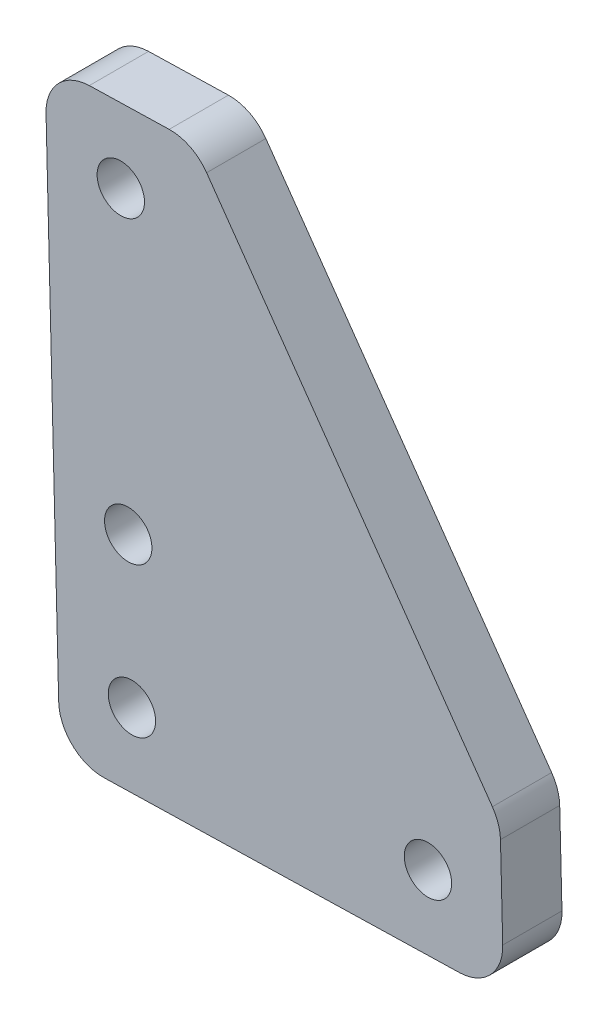
from build123d import *

# Parameters (mm, degrees)
SKETCH1_R           = 1.6
BOSS_EXTRUDE1_DEPTH = 4
FILLET2_R           = 3


with BuildPart() as part:
    # Sketch1 → Boss-Extrude1 (new body)
    # profile 1 of 3: a face of its own
    with BuildSketch(Plane.XY):
        Polygon((-2.008891974, 36.379591132), (7.987954355, 36.630715556), (8.741327627, 6.640176569), (-1.255518702, 6.389052145), align=None)
        with Locations((3.617342251, 11.513037521)):
            Circle(SKETCH1_R, mode=Mode.SUBTRACT)
        with Locations((3.115093403, 31.506730179)):
            Circle(SKETCH1_R, mode=Mode.SUBTRACT)
    # profile 2 of 3: a face of its own
    with BuildSketch(Plane.XY):
        Polygon((28.735020285, 7.142425417), (7.987954355, 36.630715556), (8.741327627, 6.640176569), align=None)
    # profile 3 of 3: a face of its own
    with BuildSketch(Plane.XY):
        Polygon((28.986144709, -2.854420912), (28.735020285, 7.142425417), (8.741327627, 6.640176569), (-1.255518702, 6.389052145), (-1.004394278, -3.607794184), align=None)
        with Locations((3.868466675, 1.516191192)):
            Circle(SKETCH1_R, mode=Mode.SUBTRACT)
        with Locations((23.862159332, 2.018440041)):
            Circle(SKETCH1_R, mode=Mode.SUBTRACT)
    extrude(amount=BOSS_EXTRUDE1_DEPTH)

    # Fillet2
    fillet2_edges = [part.edges().sort_by_distance(p)[0] for p in [
        (28.986144709, -2.854420912, 2),
        (-1.004394278, -3.607794184, 2),
        (-2.008891974, 36.379591132, 2),
        (7.987954355, 36.630715556, 2),
        (28.735020285, 7.142425417, 2),
    ]]
    fillet(fillet2_edges, radius=FILLET2_R)


solid = part.part
